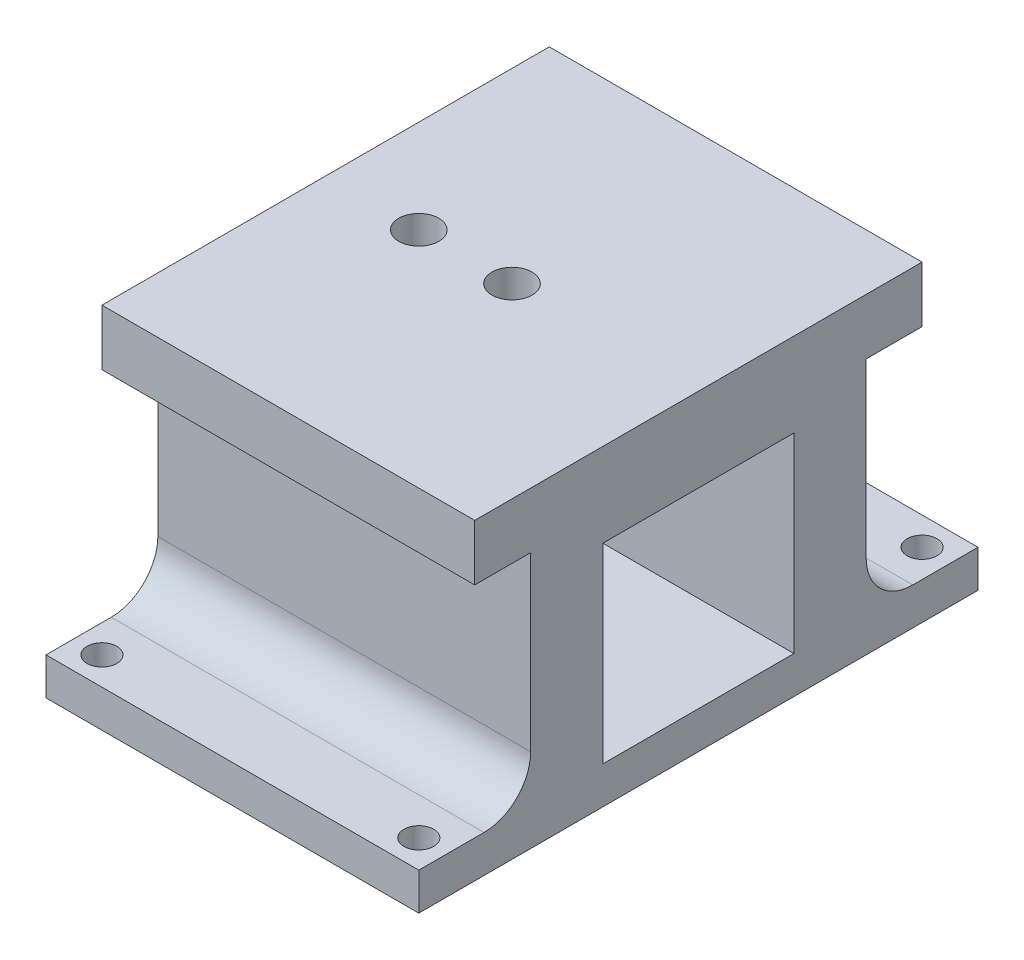
from build123d import *

# Parameters (mm, degrees)
SKETCH_1_W          = 40
SKETCH_1_H          = 48
SKETCH_1_R          = 1.75
EXTRUDE_1_DEPTH     = 4
SKETCH_2_W          = 40
SKETCH_2_H          = 7.75
EXTRUDE_5_DEPTH     = 20.5
SKETCH_4_W          = 40
SKETCH_4_H          = 36
EXTRUDE_6_DEPTH     = 3
FILLET_4_R          = 5
FILLET_11_R         = 5
SKETCH_8_W          = 40
SKETCH_8_H          = 48
EXTRUDE_8_DEPTH     = 4
SKETCH_9_W          = 40
SKETCH_9_H          = 60
EXTRUDE_9_DEPTH     = 4
SKETCH_10_R         = 1.6
CUT_EXTRUDE_1_DEPTH = 46.345892868
SKETCH_12_W         = 40
SKETCH_12_H         = 48
EXTRUDE_11_DEPTH    = 2
SKETCH_13_R         = 2.15
CUT_EXTRUDE_2_DEPTH = 50.216359069


with BuildPart() as part:
    # 草图1 → 凸台-拉伸1 (new body)
    with BuildSketch(Plane(origin=(0, 0, 0), x_dir=(1, 0, 0), z_dir=(0, 1, 0))):
        Rectangle(SKETCH_1_W, SKETCH_1_H)
        with Locations(Location((11.45, 14, 0), (0, 0, 270))):
            Circle(SKETCH_1_R, mode=Mode.SUBTRACT)
        with Locations(Location((-11.45, 14, 0), (0, 0, 270))):
            Circle(SKETCH_1_R, mode=Mode.SUBTRACT)
        with Locations(Location((-11.45, -14, 0), (0, 0, 270))):
            Circle(SKETCH_1_R, mode=Mode.SUBTRACT)
        with Locations(Location((11.45, -14, 0), (0, 0, 270))):
            Circle(SKETCH_1_R, mode=Mode.SUBTRACT)
        with BuildLine():
            Line((-2.45, -15.5), (-2.45, 15.5))
            ThreePointArc((-2.45, 15.5), (0, 17.95), (2.45, 15.5))
            Line((2.45, 15.5), (2.45, -15.5))
            ThreePointArc((2.45, -15.5), (0, -17.95), (-2.45, -15.5))
        make_face(mode=Mode.SUBTRACT)
    extrude(amount=EXTRUDE_1_DEPTH)

    # 草图2 → 凸台-拉伸5 (add)
    with BuildSketch(Plane(origin=(0, 4, 0), x_dir=(1, 0, 0), z_dir=(0, 1, 0))):
        with Locations((0, -14.125)):
            Rectangle(SKETCH_2_W, SKETCH_2_H)
        with Locations((0, 14.125)):
            Rectangle(SKETCH_2_W, SKETCH_2_H)
    extrude(amount=EXTRUDE_5_DEPTH)

    # 草图4 → 凸台-拉伸6 (add)
    with BuildSketch(Plane(origin=(0, 24.5, 0), x_dir=(1, 0, 0), z_dir=(0, 1, 0))):
        Rectangle(SKETCH_4_W, SKETCH_4_H)
    extrude(amount=EXTRUDE_6_DEPTH)

    # 圆角4
    fillet_4_edges = [part.edges().sort_by_distance(p)[0] for p in [
        (0, 4, -18),
    ]]
    fillet(fillet_4_edges, radius=FILLET_4_R)

    # 圆角11
    fillet_11_edges = [part.edges().sort_by_distance(p)[0] for p in [
        (0, 4, 18),
    ]]
    fillet(fillet_11_edges, radius=FILLET_11_R)

    # 草图8 → 凸台-拉伸8 (add)
    with BuildSketch(Plane(origin=(0, 27.5, 0), x_dir=(1, 0, 0), z_dir=(0, 1, 0))):
        Rectangle(SKETCH_8_W, SKETCH_8_H)
    extrude(amount=EXTRUDE_8_DEPTH)

    # 草图9 → 凸台-拉伸9 (add)
    with BuildSketch(Plane.XZ):
        Rectangle(SKETCH_9_W, SKETCH_9_H)
    extrude(amount=-EXTRUDE_9_DEPTH)

    # 草图10 → 切除-拉伸1 (cut, through all)
    with BuildSketch(Plane(origin=(0, 4, 0), x_dir=(1, 0, 0), z_dir=(0, 1, 0))):
        with Locations(Location((17, 27, 0), (0, 0, 270))):
            Circle(SKETCH_10_R)
        with Locations(Location((-17, -27, 0), (0, 0, 270))):
            Circle(SKETCH_10_R)
        with Locations(Location((17, -27, 0), (0, 0, 270))):
            Circle(SKETCH_10_R)
        with Locations(Location((-17, 27, 0), (0, 0, 270))):
            Circle(SKETCH_10_R)
    extrude(amount=-CUT_EXTRUDE_1_DEPTH, mode=Mode.SUBTRACT)

    # 草图12 → 凸台-拉伸11 (add)
    with BuildSketch(Plane(origin=(0, 31.5, 0), x_dir=(1, 0, 0), z_dir=(0, 1, 0))):
        Rectangle(SKETCH_12_W, SKETCH_12_H)
    extrude(amount=EXTRUDE_11_DEPTH)

    # 草图13 → 切除-拉伸2 (cut, through all)
    with BuildSketch(Plane(origin=(0, 33.5, 0), x_dir=(1, 0, 0), z_dir=(0, 1, 0))):
        with Locations(Location((-10, 0, 0), (0, 0, 270))):
            Circle(SKETCH_13_R)
        with Locations(Location((0, 0, 0), (0, 0, 270))):
            Circle(SKETCH_13_R)
    extrude(amount=-CUT_EXTRUDE_2_DEPTH, mode=Mode.SUBTRACT)


solid = part.part
